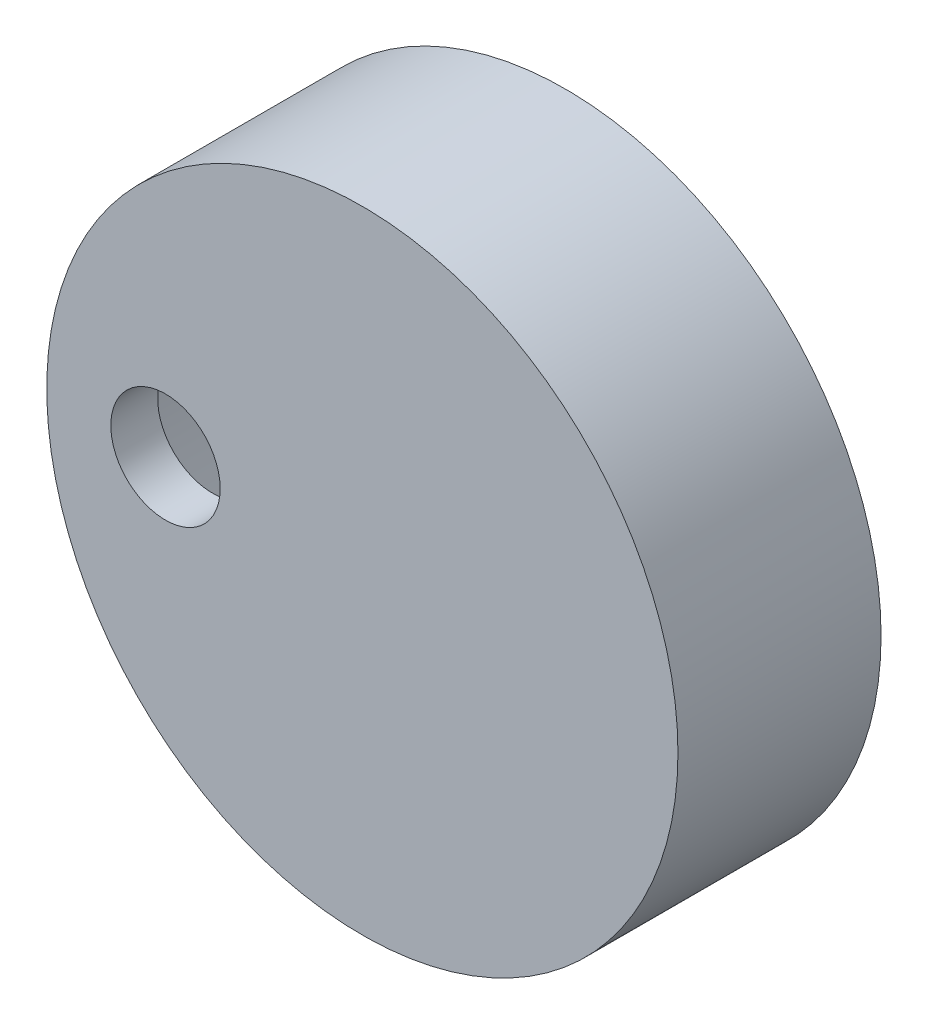
from build123d import *

# Parameters (mm, degrees)
BOSS_EXTRUDE1_DEPTH      = 1.5
BOSS_EXTRUDE1_DEPTH_BACK = 5
SKETCH1_R                = 10.1
SKETCH1_R_2              = 8.6
SKETCH2_R                = 10.1
BOSS_EXTRUDE2_DEPTH      = 1.5
SKETCH3_R                = 1.75
CUT_EXTRUDE1_DEPTH       = 1.5


with BuildPart() as part:
    # Sketch1 → Boss-Extrude1 (new, two sides: drawn at the far end of the back side and taken through both)
    with BuildSketch(Plane.XY.offset(-BOSS_EXTRUDE1_DEPTH_BACK)):
        with Locations((-10.160617153, 18.12022925)):
            Circle(SKETCH1_R)
        with Locations((-10.160617153, 18.12022925)):
            Circle(SKETCH1_R_2, mode=Mode.SUBTRACT)
    extrude(amount=BOSS_EXTRUDE1_DEPTH + BOSS_EXTRUDE1_DEPTH_BACK)

    # Sketch2 → Boss-Extrude2 (add)
    with BuildSketch(Plane.XY.offset(1.5)):
        with Locations((-10.160617153, 18.12022925)):
            Circle(SKETCH2_R)
    extrude(amount=-BOSS_EXTRUDE2_DEPTH)

    # Sketch3 → Cut-Extrude1 (cut)
    with BuildSketch(Plane.XY.offset(1.5)):
        with Locations((-16.460617153, 18.12022925)):
            Circle(SKETCH3_R)
    extrude(amount=-CUT_EXTRUDE1_DEPTH, mode=Mode.SUBTRACT)


solid = part.part
